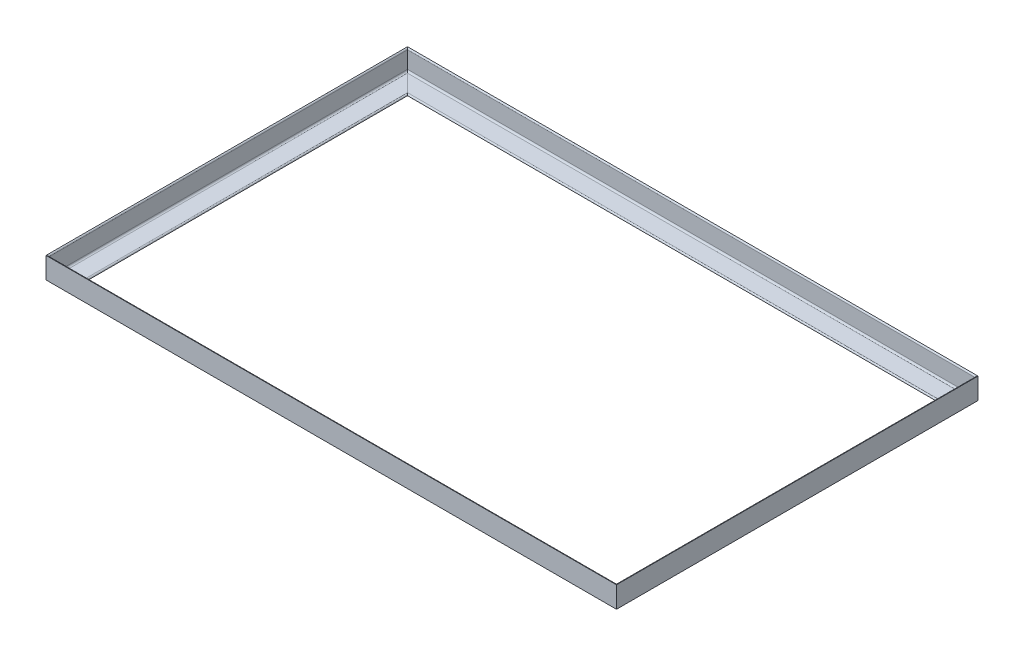
from build123d import *

# Parameters (mm, degrees)
HIERRO_ANGULAR_3_X_2_X_0_25_1_DEPTH      = 1874.684097937
HIERRO_ANGULAR_3_X_2_X_0_25_1_DEPTH_BACK = 144.684097937
HIERRO_ANGULAR_3_X_2_X_0_25_1_2_DEPTH    = 3019.368195874
HIERRO_ANGULAR_3_X_2_X_0_25_1_3_DEPTH    = 2019.368195874
HIERRO_ANGULAR_3_X_2_X_0_25_1_4_DEPTH    = 3019.368195874


with BuildPart() as part:
    # Sketch1 → Hierro angular 3 X 2 X 0.25(1) (new, two sides: drawn at the far end of the back side and taken through both)
    with BuildSketch(Plane(origin=(-1365, 0, -865), x_dir=(1, 0, 0), z_dir=(0, 0, 1)).offset(-HIERRO_ANGULAR_3_X_2_X_0_25_1_DEPTH_BACK)):
        with BuildLine():
            Line((0, 0), (0, 101.6))
            Line((0, 101.6), (0.00508, 101.6))
            ThreePointArc((0.00508, 101.6), (4.491615958, 99.741615958), (6.35, 95.25508))
            Line((6.35, 95.25508), (6.35, 14.2875))
            ThreePointArc((6.35, 14.2875), (8.674839924, 8.674839924), (14.2875, 6.35))
            Line((14.2875, 6.35), (95.25508, 6.35))
            ThreePointArc((95.25508, 6.35), (99.741615958, 4.491615958), (101.6, 0.00508))
            Line((101.6, 0.00508), (101.6, 0))
            Line((101.6, 0), (0, 0))
        make_face()
    extrude(amount=HIERRO_ANGULAR_3_X_2_X_0_25_1_DEPTH + HIERRO_ANGULAR_3_X_2_X_0_25_1_DEPTH_BACK)

    # Hierro angular 3 X 2 X 0.25(1) mitre 1
    split(bisect_by=Plane(origin=(-1365, 0, -865), x_dir=(0, -1, 0), z_dir=(-0.707106781, 0, 0.707106781)), keep=Keep.TOP)

    # Hierro angular 3 X 2 X 0.25(1) mitre 2
    split(bisect_by=Plane(origin=(-1365, 0, 865), x_dir=(0, -1, 0), z_dir=(-0.707106781, 0, -0.707106781)), keep=Keep.TOP)


with BuildPart() as body_2:
    # Sketch1 on segment 2 (carried to segment 2) → Hierro angular 3 X 2 X 0.25_1 2 (new body)
    with BuildSketch(Plane(origin=(-1509.684097937, 0, 865), x_dir=(0, 0, -1), z_dir=(1, 0, 0))):
        with BuildLine():
            Line((0, 0), (0, 101.6))
            Line((0, 101.6), (0.00508, 101.6))
            ThreePointArc((0.00508, 101.6), (4.491615958, 99.741615958), (6.35, 95.25508))
            Line((6.35, 95.25508), (6.35, 14.2875))
            ThreePointArc((6.35, 14.2875), (8.674839924, 8.674839924), (14.2875, 6.35))
            Line((14.2875, 6.35), (95.25508, 6.35))
            ThreePointArc((95.25508, 6.35), (99.741615958, 4.491615958), (101.6, 0.00508))
            Line((101.6, 0.00508), (101.6, 0))
            Line((101.6, 0), (0, 0))
        make_face()
    extrude(amount=HIERRO_ANGULAR_3_X_2_X_0_25_1_2_DEPTH)

    # Hierro angular 3 X 2 X 0.25_1 2 mitre 1
    split(bisect_by=Plane(origin=(-1365, 0, 865), x_dir=(0, 1, 0), z_dir=(0.707106781, 0, 0.707106781)), keep=Keep.TOP)

    # Hierro angular 3 X 2 X 0.25_1 2 mitre 2
    split(bisect_by=Plane(origin=(1365, 0, 865), x_dir=(0, -1, 0), z_dir=(-0.707106781, 0, 0.707106781)), keep=Keep.TOP)


with BuildPart() as body_3:
    # Sketch1 on segment 3 (carried to segment 3) → Hierro angular 3 X 2 X 0.25_1 3 (new body)
    with BuildSketch(Plane(origin=(1365, 0, 1009.684097937), x_dir=(-1, 0, 0), z_dir=(0, 0, -1))):
        with BuildLine():
            Line((0, 0), (0, 101.6))
            Line((0, 101.6), (0.00508, 101.6))
            ThreePointArc((0.00508, 101.6), (4.491615958, 99.741615958), (6.35, 95.25508))
            Line((6.35, 95.25508), (6.35, 14.2875))
            ThreePointArc((6.35, 14.2875), (8.674839924, 8.674839924), (14.2875, 6.35))
            Line((14.2875, 6.35), (95.25508, 6.35))
            ThreePointArc((95.25508, 6.35), (99.741615958, 4.491615958), (101.6, 0.00508))
            Line((101.6, 0.00508), (101.6, 0))
            Line((101.6, 0), (0, 0))
        make_face()
    extrude(amount=HIERRO_ANGULAR_3_X_2_X_0_25_1_3_DEPTH)

    # Hierro angular 3 X 2 X 0.25_1 3 mitre 1
    split(bisect_by=Plane(origin=(1365, 0, -865), x_dir=(0, 1, 0), z_dir=(0.707106781, 0, 0.707106781)), keep=Keep.TOP)

    # Hierro angular 3 X 2 X 0.25_1 3 mitre 2
    split(bisect_by=Plane(origin=(1365, 0, 865), x_dir=(0, 1, 0), z_dir=(0.707106781, 0, -0.707106781)), keep=Keep.TOP)


with BuildPart() as body_4:
    # Sketch1 on segment 4 (carried to segment 4) → Hierro angular 3 X 2 X 0.25_1 4 (new body)
    with BuildSketch(Plane(origin=(1509.684097937, 0, -865), x_dir=(0, 0, 1), z_dir=(-1, 0, 0))):
        with BuildLine():
            Line((0, 0), (0, 101.6))
            Line((0, 101.6), (0.00508, 101.6))
            ThreePointArc((0.00508, 101.6), (4.491615958, 99.741615958), (6.35, 95.25508))
            Line((6.35, 95.25508), (6.35, 14.2875))
            ThreePointArc((6.35, 14.2875), (8.674839924, 8.674839924), (14.2875, 6.35))
            Line((14.2875, 6.35), (95.25508, 6.35))
            ThreePointArc((95.25508, 6.35), (99.741615958, 4.491615958), (101.6, 0.00508))
            Line((101.6, 0.00508), (101.6, 0))
            Line((101.6, 0), (0, 0))
        make_face()
    extrude(amount=HIERRO_ANGULAR_3_X_2_X_0_25_1_4_DEPTH)

    # Hierro angular 3 X 2 X 0.25_1 4 mitre 1
    split(bisect_by=Plane(origin=(-1365, 0, -865), x_dir=(0, 1, 0), z_dir=(0.707106781, 0, -0.707106781)), keep=Keep.TOP)

    # Hierro angular 3 X 2 X 0.25_1 4 mitre 2
    split(bisect_by=Plane(origin=(1365, 0, -865), x_dir=(0, -1, 0), z_dir=(-0.707106781, 0, -0.707106781)), keep=Keep.TOP)


solid = Compound([part.part, body_2.part, body_3.part, body_4.part])
